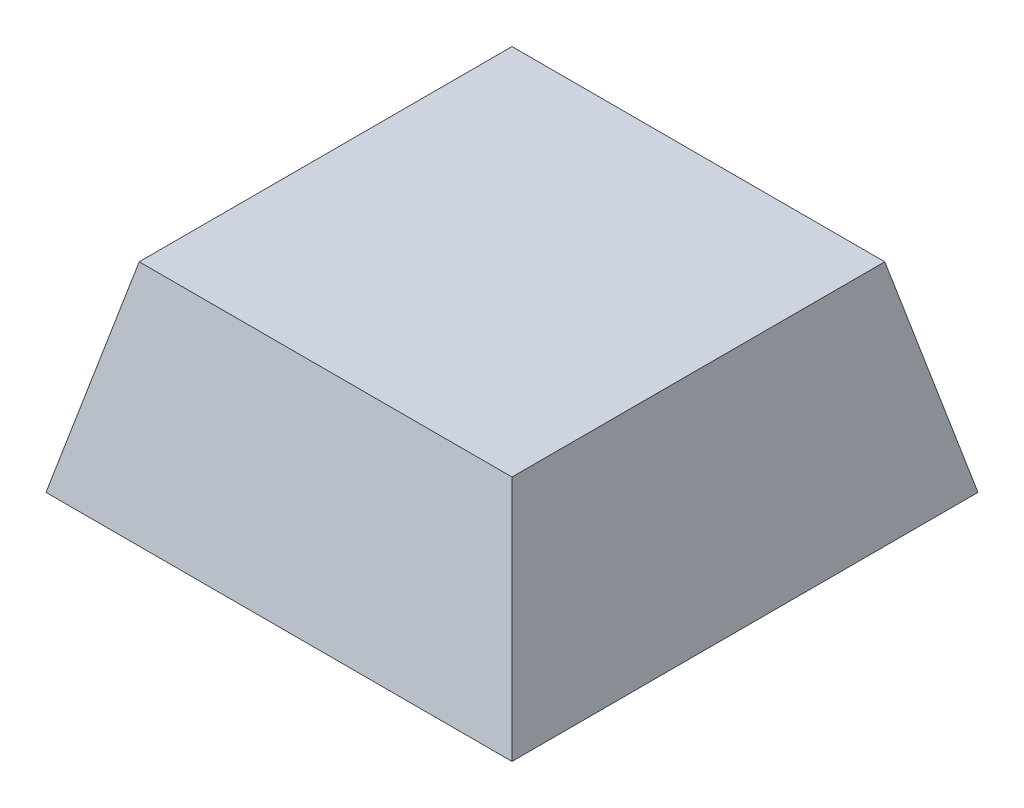
from build123d import *

# Parameters (mm, degrees)
SKETCH1_W           = 7
SKETCH1_H           = 7
BOSS_EXTRUDE1_DEPTH = 3
CUT_EXTRUDE1_DEPTH  = 7
CUT_EXTRUDE2_DEPTH  = 11
SKETCH4_R           = 1.8
CUT_EXTRUDE3_DEPTH  = 0.8


with BuildPart() as part:
    # Sketch1 → Boss-Extrude1 (new body)
    with BuildSketch(Plane(origin=(0, 0, 0), x_dir=(1, 0, 0), z_dir=(0, 1, 0))):
        with Locations((3.5, 3.5)):
            Rectangle(SKETCH1_W, SKETCH1_H)
    extrude(amount=BOSS_EXTRUDE1_DEPTH)

    # Sketch2 → Cut-Extrude1 (cut)
    with BuildSketch(Plane.XY):
        Polygon((0, 0), (0.7, 3), (0, 3), align=None)
        Polygon((7, 0), (6.3, 3), (7, 3), align=None)
    extrude(amount=-CUT_EXTRUDE1_DEPTH, mode=Mode.SUBTRACT)

    # Sketch3 → Cut-Extrude2 (cut)
    with BuildSketch(Plane(origin=(0, 0, 0), x_dir=(0, 0, -1), z_dir=(1, 0, 0))):
        Polygon((0, 0), (0.7, 3), (0, 3), align=None)
        Polygon((7, 3), (6.3, 3), (7, 0), align=None)
    extrude(amount=CUT_EXTRUDE2_DEPTH, mode=Mode.SUBTRACT)

    # Sketch4 → Cut-Extrude3 (cut)
    with BuildSketch(Plane.XZ):
        with Locations(Location((3.5, -3.5, 0), (0, 0, 270))):
            Circle(SKETCH4_R)
    extrude(amount=-CUT_EXTRUDE3_DEPTH, mode=Mode.SUBTRACT)


solid = part.part
